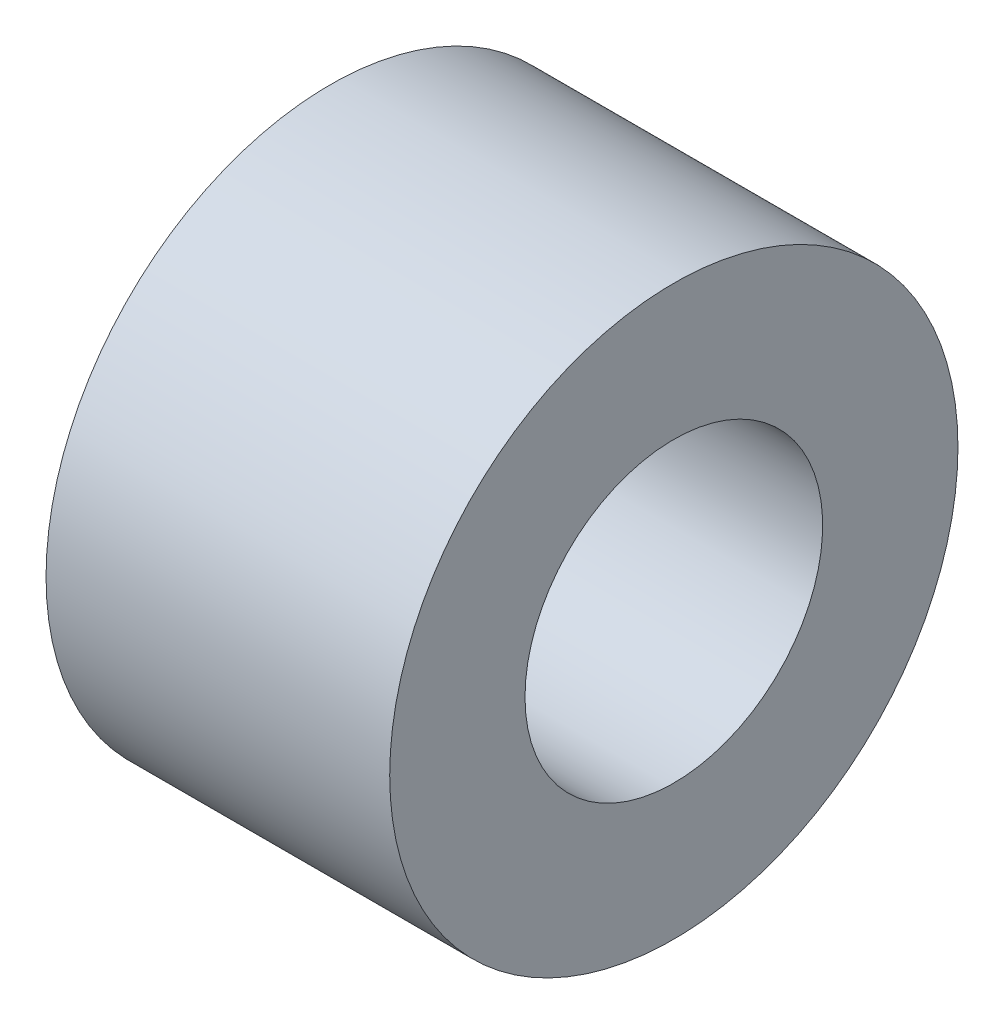
from build123d import *

# Parameters (mm, degrees)
SKETCH1_W = 25.4
SKETCH1_H = 10


with BuildPart() as part:
    # Sketch1 → Revolve1 (revolve)
    with BuildSketch(Plane.XY, mode=Mode.PRIVATE) as revolve1_sk:
        with Locations((0, 16)):
            Rectangle(SKETCH1_W, SKETCH1_H)
    revolve(revolve1_sk.sketch.rotate(Axis((-32.319313559, 0, 0), (1, 0, 0)), 90), axis=Axis((-32.319313559, 0, 0), (1, 0, 0)))


solid = part.part
